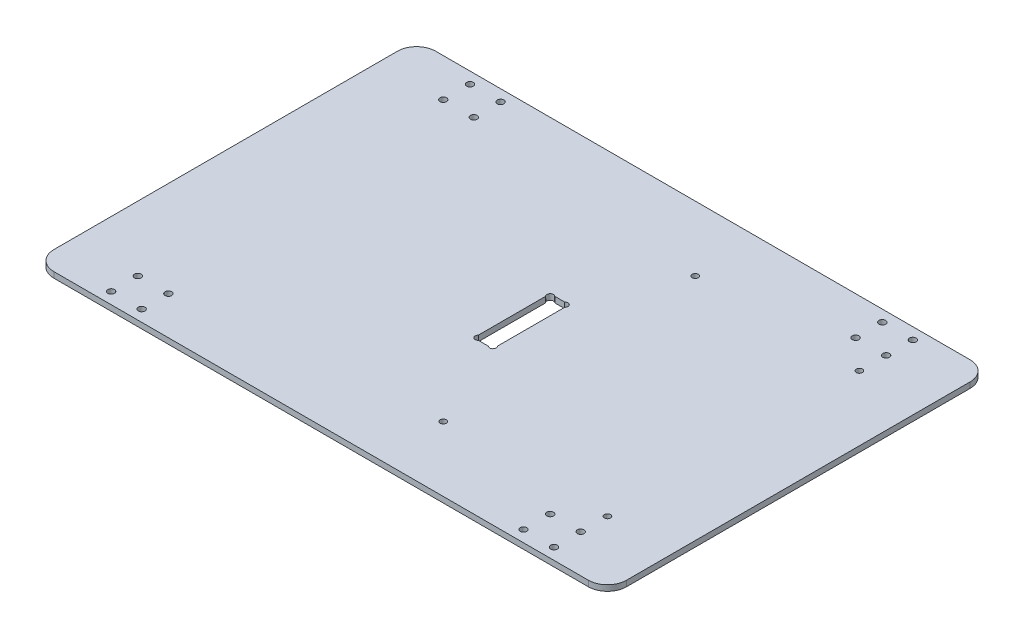
from build123d import *

# Parameters (mm, degrees)
EXTRUDE_1_DEPTH     = 3
SKETCH_15_R         = 1.75
SKETCH_15_R_2       = 1.6
CUT_EXTRUDE_7_DEPTH = 3


with BuildPart() as part:
    # 草图1 → 凸台-拉伸1 (new body)
    with BuildSketch(Plane(origin=(0, 0, 0), x_dir=(1, 0, 0), z_dir=(0, 1, 0))):
        with BuildLine():
            Line((-140, 100), (140, 100))
            ThreePointArc((140, 100), (147.071067812, 97.071067812), (150, 90))
            Line((150, 90), (150, -90))
            ThreePointArc((150, -90), (147.071067812, -97.071067812), (140, -100))
            Line((140, -100), (-140, -100))
            ThreePointArc((-140, -100), (-147.071067812, -97.071067812), (-150, -90))
            Line((-150, -90), (-150, 90))
            ThreePointArc((-150, 90), (-147.071067812, 97.071067812), (-140, 100))
        make_face()
    extrude(amount=EXTRUDE_1_DEPTH)

    # 草图15 → 切除-拉伸7 (cut)
    with BuildSketch(Plane(origin=(0, 3, 0), x_dir=(1, 0, 0), z_dir=(0, 1, 0))):
        with Locations(Location((-116, 94, 0), (0, 0, 270))):
            Circle(SKETCH_15_R)
        with Locations(Location((-100, 94, 0), (0, 0, 270))):
            Circle(SKETCH_15_R)
        with Locations(Location((-116, 80, 0), (0, 0, 270))):
            Circle(SKETCH_15_R)
        with Locations(Location((-100, 80, 0), (0, 0, 270))):
            Circle(SKETCH_15_R)
        with Locations(Location((-116, -80, 0), (0, 0, 270))):
            Circle(SKETCH_15_R)
        with Locations(Location((-100, -80, 0), (0, 0, 270))):
            Circle(SKETCH_15_R)
        with Locations(Location((-116, -94, 0), (0, 0, 270))):
            Circle(SKETCH_15_R)
        with Locations(Location((-100, -94, 0), (0, 0, 270))):
            Circle(SKETCH_15_R)
        with Locations(Location((100, -80, 0), (0, 0, 270))):
            Circle(SKETCH_15_R)
        with Locations(Location((116, -80, 0), (0, 0, 270))):
            Circle(SKETCH_15_R)
        with Locations(Location((100, -94, 0), (0, 0, 270))):
            Circle(SKETCH_15_R)
        with Locations(Location((100, 94, 0), (0, 0, 270))):
            Circle(SKETCH_15_R)
        with Locations(Location((116, 94, 0), (0, 0, 270))):
            Circle(SKETCH_15_R)
        with Locations(Location((100, 80, 0), (0, 0, 270))):
            Circle(SKETCH_15_R)
        with Locations(Location((116, 80, 0), (0, 0, 270))):
            Circle(SKETCH_15_R)
        with Locations(Location((116, -94, 0), (0, 0, 270))):
            Circle(SKETCH_15_R)
        with Locations(Location((30, 66, 0), (0, 0, 270))):
            Circle(SKETCH_15_R_2)
        with Locations(Location((116, 66, 0), (0, 0, 270))):
            Circle(SKETCH_15_R_2)
        with Locations(Location((30, -66, 0), (0, 0, 270))):
            Circle(SKETCH_15_R_2)
        with Locations(Location((116, -66, 0), (0, 0, 270))):
            Circle(SKETCH_15_R_2)
        with BuildLine():
            Line((2.404159458, 20), (7.595840542, 20))
            ThreePointArc((7.595840542, 20), (10.002081528, 20.002081528), (10, 17.595840542))
            Line((10, 17.595840542), (10, -17.595840542))
            ThreePointArc((10, -17.595840542), (10.002081528, -20.002081528), (7.595840542, -20))
            Line((7.595840542, -20), (2.404159458, -20))
            ThreePointArc((2.404159458, -20), (-0.002081528, -20.002081528), (0, -17.595840542))
            Line((0, -17.595840542), (0, 17.595840542))
            ThreePointArc((0, 17.595840542), (-0.002081528, 20.002081528), (2.404159458, 20))
        make_face()
    extrude(amount=-CUT_EXTRUDE_7_DEPTH, mode=Mode.SUBTRACT)


solid = part.part
